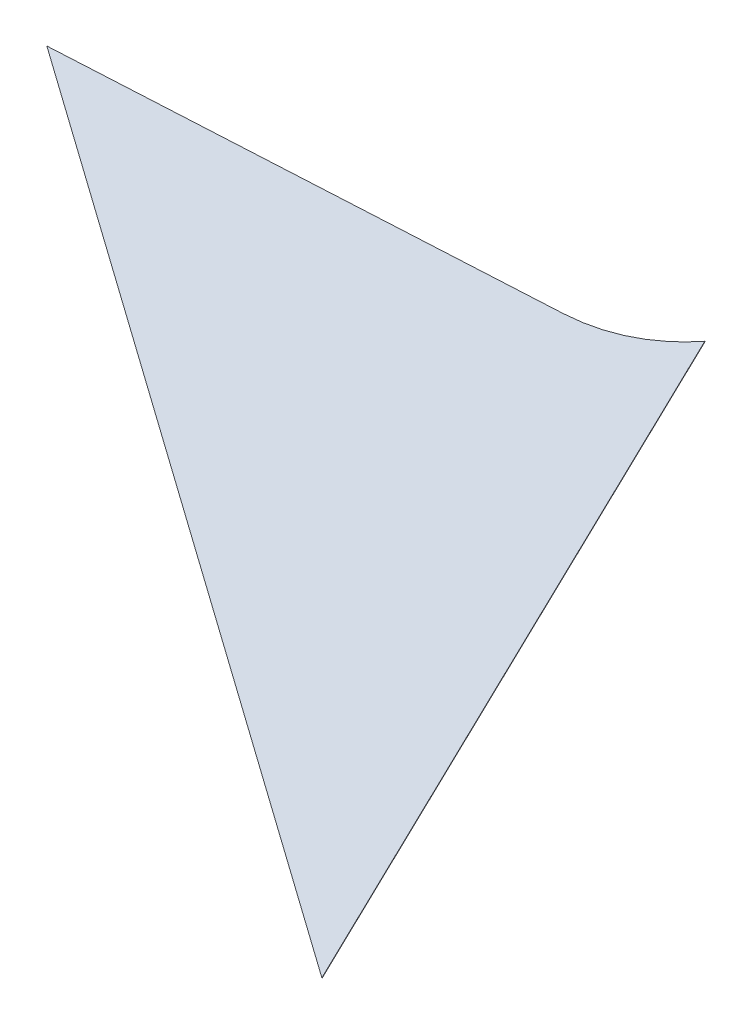
from build123d import *

# Parameters (mm, degrees)
BOSS_EXTRUDE1_DEPTH = 0.0762


with BuildPart() as part:
    # Sketch2 → Boss-Extrude1 (new, symmetric)
    with BuildSketch(Plane(origin=(-109.649906409, -282.836957695, -713.595872526), x_dir=(0.998460453708484, 0.05529862010587768, 0.004334165967541292), z_dir=(0.04480550370073853, -0.7579973701260059, -0.6507168767752854))):
        with BuildLine():
            Line((40.522667634, 135.902493489), (198.13852487, 135.902493489))
            add(Edge.make_bspline(
                [(235, 127.150580223), (217.608315086, 135.902493489), (198.13852487, 135.902493489)],
                knots=[1.10455701, 1.10455701, 1.10455701, 1.570796327, 1.570796327, 1.570796327], degree=2, weights=[1, 0.972950446, 1]))
            Line((235, 127.150580223), (235, 287.108094093))
            Line((235, 287.108094093), (40.522667634, 135.902493489))
        make_face()
    extrude(amount=BOSS_EXTRUDE1_DEPTH, both=True)


solid = part.part
